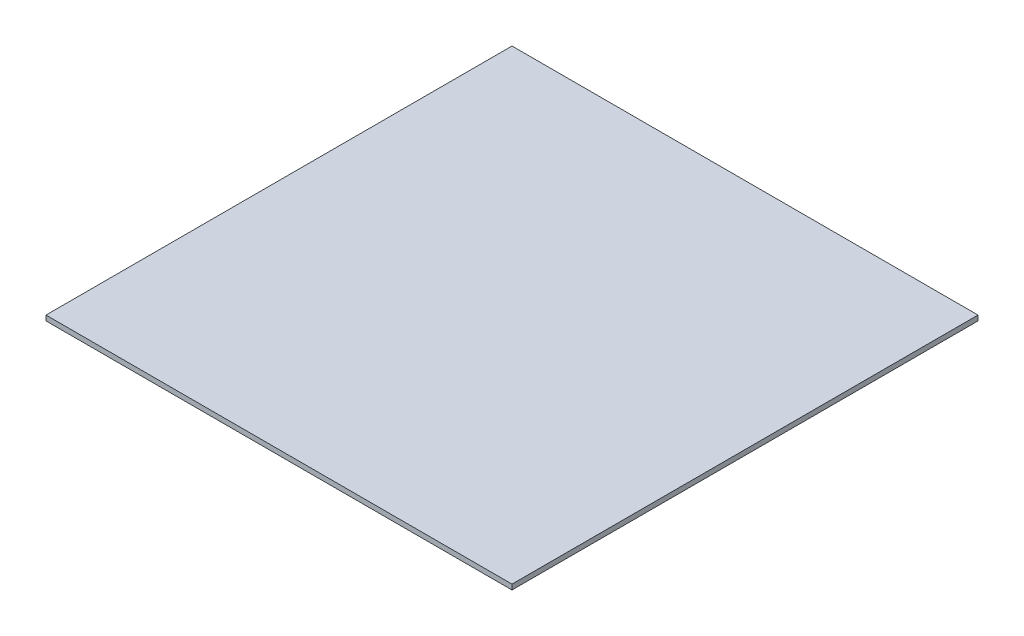
from build123d import *

# Parameters (mm, degrees)
SKETCH1_W           = 290
SKETCH1_H           = 290
BOSS_EXTRUDE1_DEPTH = 1.5875


with BuildPart() as part:
    # Sketch1 → Boss-Extrude1 (new, symmetric)
    with BuildSketch(Plane(origin=(0, 0, 0), x_dir=(1, 0, 0), z_dir=(0, 1, 0))):
        Rectangle(SKETCH1_W, SKETCH1_H)
    extrude(amount=BOSS_EXTRUDE1_DEPTH, both=True)


solid = part.part
